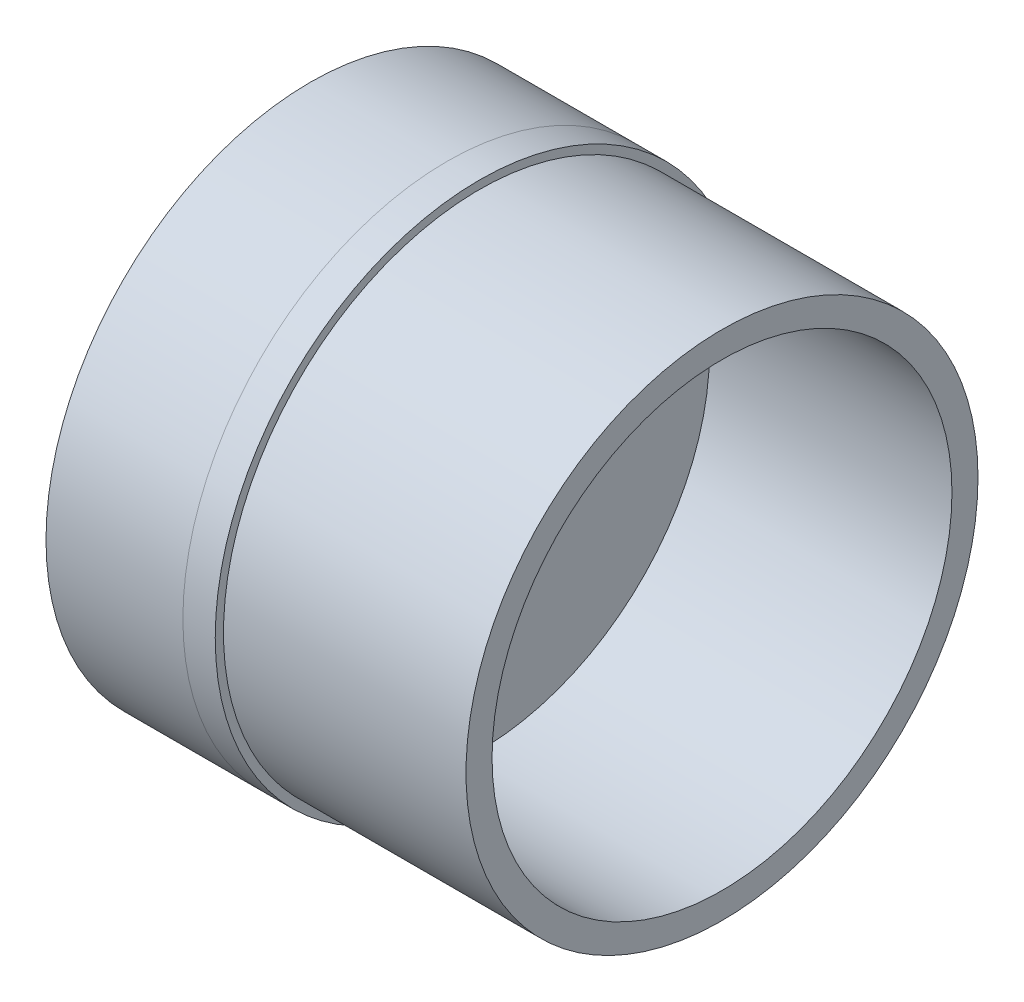
from build123d import *

# Parameters (mm, degrees)
SKETCH1_W           = 44.03
SKETCH1_H           = 6
SKETCH1_W_2         = 4.831168831
SKETCH1_H_2         = 45
SKETCH2_R           = 49.03
SKETCH2_R_2         = 5
BOSS_EXTRUDE1_DEPTH = 25.4


with BuildPart() as part:
    # Sketch1 → Revolve1 (revolve)
    with BuildSketch(Plane(origin=(0, 0, 0), x_dir=(0, 1, 0), z_dir=(0, 0, 1)), mode=Mode.PRIVATE) as revolve1_sk:
        with Locations((27.015, 3)):
            Rectangle(SKETCH1_W, SKETCH1_H)
        with Locations((45.084415585, -22.5)):
            Rectangle(SKETCH1_W_2, SKETCH1_H_2)
    revolve(revolve1_sk.sketch.rotate(Axis((0, 0, 0), (-1, 0, 0)), 90), axis=Axis((0, 0, 0), (-1, 0, 0)))


with BuildPart() as body_2:
    # Sketch2 → Boss-Extrude1 (new body)
    with BuildSketch(Plane(origin=(-6, 0, 0), x_dir=(0, -1, 0), z_dir=(-1, 0, 0))):
        with Locations(Location((0, 0, 0), (0, 0, 90))):
            Circle(SKETCH2_R)
        with Locations(Location((0, 0, 0), (0, 0, 90))):
            Circle(SKETCH2_R_2, mode=Mode.SUBTRACT)
    extrude(amount=BOSS_EXTRUDE1_DEPTH)


solid = Compound([part.part, body_2.part])
